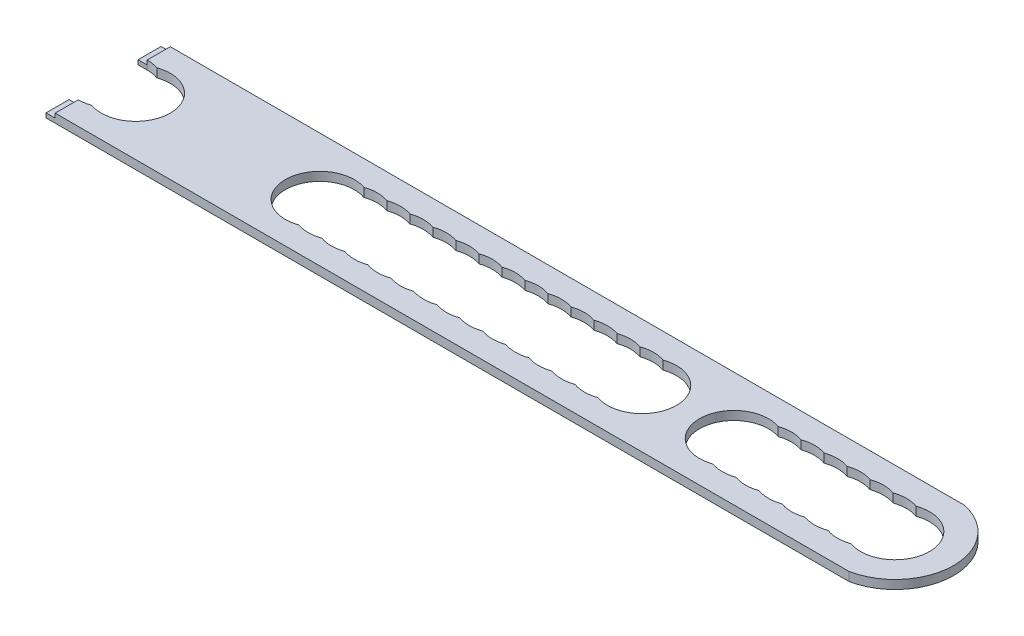
from build123d import *

# Parameters (mm, degrees)
BOSS_EXTRUDE1_DEPTH = 1.9
SKETCH2_W           = 2
SKETCH2_H           = 5
BOSS_EXTRUDE2_DEPTH = 0.95


with BuildPart() as part:
    # Sketch1 → Boss-Extrude1 (new body)
    with BuildSketch(Plane(origin=(0, 0, 0), x_dir=(1, 0, 0), z_dir=(0, 1, 0))):
        with BuildLine():
            Line((172.5, 12.5), (0, 12.5))
            Line((0, 12.5), (0, 7.5))
            ThreePointArc((0, 7.5), (1.26826484, 7.391989197), (2.5, 7.071067812))
            ThreePointArc((2.5, 7.071067812), (12.5, 0), (2.5, -7.071067812))
            ThreePointArc((2.5, -7.071067812), (1.26826484, -7.391989197), (0, -7.5))
            Line((0, -7.5), (0, -12.5))
            Line((0, -12.5), (172.5, -12.5))
            ThreePointArc((172.5, -12.5), (182.747548784, 0), (172.5, 12.5))
        make_face()
        with BuildLine():
            ThreePointArc((47.5, -7.071067812), (37.5, 0), (47.5, 7.071067812))
            ThreePointArc((47.5, 7.071067812), (50, 7.5), (52.5, 7.071067812))
            ThreePointArc((52.5, 7.071067812), (55, 7.5), (57.5, 7.071067812))
            ThreePointArc((57.5, 7.071067812), (60, 7.5), (62.5, 7.071067812))
            ThreePointArc((62.5, 7.071067812), (65, 7.5), (67.5, 7.071067812))
            ThreePointArc((67.5, 7.071067812), (70, 7.5), (72.5, 7.071067812))
            ThreePointArc((72.5, 7.071067812), (75, 7.5), (77.5, 7.071067812))
            ThreePointArc((77.5, 7.071067812), (80, 7.5), (82.5, 7.071067812))
            ThreePointArc((82.5, 7.071067812), (85, 7.5), (87.5, 7.071067812))
            ThreePointArc((87.5, 7.071067812), (90, 7.5), (92.5, 7.071067812))
            ThreePointArc((92.5, 7.071067812), (95, 7.5), (97.5, 7.071067812))
            ThreePointArc((97.5, 7.071067812), (100, 7.5), (102.5, 7.071067812))
            ThreePointArc((102.5, 7.071067812), (105, 7.5), (107.5, 7.071067812))
            ThreePointArc((107.5, 7.071067812), (110, 7.5), (112.5, 7.071067812))
            ThreePointArc((112.5, 7.071067812), (122.5, 0), (112.5, -7.071067812))
            ThreePointArc((112.5, -7.071067812), (110, -7.5), (107.5, -7.071067812))
            ThreePointArc((107.5, -7.071067812), (105, -7.5), (102.5, -7.071067812))
            ThreePointArc((102.5, -7.071067812), (100, -7.5), (97.5, -7.071067812))
            ThreePointArc((97.5, -7.071067812), (95, -7.5), (92.5, -7.071067812))
            ThreePointArc((92.5, -7.071067812), (90, -7.5), (87.5, -7.071067812))
            ThreePointArc((87.5, -7.071067812), (85, -7.5), (82.5, -7.071067812))
            ThreePointArc((82.5, -7.071067812), (80, -7.5), (77.5, -7.071067812))
            ThreePointArc((77.5, -7.071067812), (75, -7.5), (72.5, -7.071067812))
            ThreePointArc((72.5, -7.071067812), (70, -7.5), (67.5, -7.071067812))
            ThreePointArc((67.5, -7.071067812), (65, -7.5), (62.5, -7.071067812))
            ThreePointArc((62.5, -7.071067812), (60, -7.5), (57.5, -7.071067812))
            ThreePointArc((57.5, -7.071067812), (55, -7.5), (52.5, -7.071067812))
            ThreePointArc((52.5, -7.071067812), (50, -7.5), (47.5, -7.071067812))
        make_face(mode=Mode.SUBTRACT)
        with BuildLine():
            ThreePointArc((137.5, 7.071067812), (140, 7.5), (142.5, 7.071067812))
            ThreePointArc((142.5, 7.071067812), (145, 7.5), (147.5, 7.071067812))
            ThreePointArc((147.5, 7.071067812), (150, 7.5), (152.5, 7.071067812))
            ThreePointArc((152.5, 7.071067812), (155, 7.5), (157.5, 7.071067812))
            ThreePointArc((157.5, 7.071067812), (160, 7.5), (162.5, 7.071067812))
            ThreePointArc((162.5, 7.071067812), (165, 7.5), (167.5, 7.071067812))
            ThreePointArc((167.5, 7.071067812), (177.5, 0), (167.5, -7.071067812))
            ThreePointArc((167.5, -7.071067812), (165, -7.5), (162.5, -7.071067812))
            ThreePointArc((162.5, -7.071067812), (160, -7.5), (157.5, -7.071067812))
            ThreePointArc((157.5, -7.071067812), (155, -7.5), (152.5, -7.071067812))
            ThreePointArc((152.5, -7.071067812), (150, -7.5), (147.5, -7.071067812))
            ThreePointArc((147.5, -7.071067812), (145, -7.5), (142.5, -7.071067812))
            ThreePointArc((142.5, -7.071067812), (140, -7.5), (137.5, -7.071067812))
            ThreePointArc((137.5, -7.071067812), (127.5, 0), (137.5, 7.071067812))
        make_face(mode=Mode.SUBTRACT)
    extrude(amount=BOSS_EXTRUDE1_DEPTH)

    # Sketch2 → Boss-Extrude2 (add)
    with BuildSketch(Plane(origin=(0, 0, 0), x_dir=(1, 0, 0), z_dir=(0, 1, 0))):
        with Locations((-1, 10)):
            Rectangle(SKETCH2_W, SKETCH2_H)
        with Locations((-1, -10)):
            Rectangle(SKETCH2_W, SKETCH2_H)
    extrude(amount=BOSS_EXTRUDE2_DEPTH)


solid = part.part
